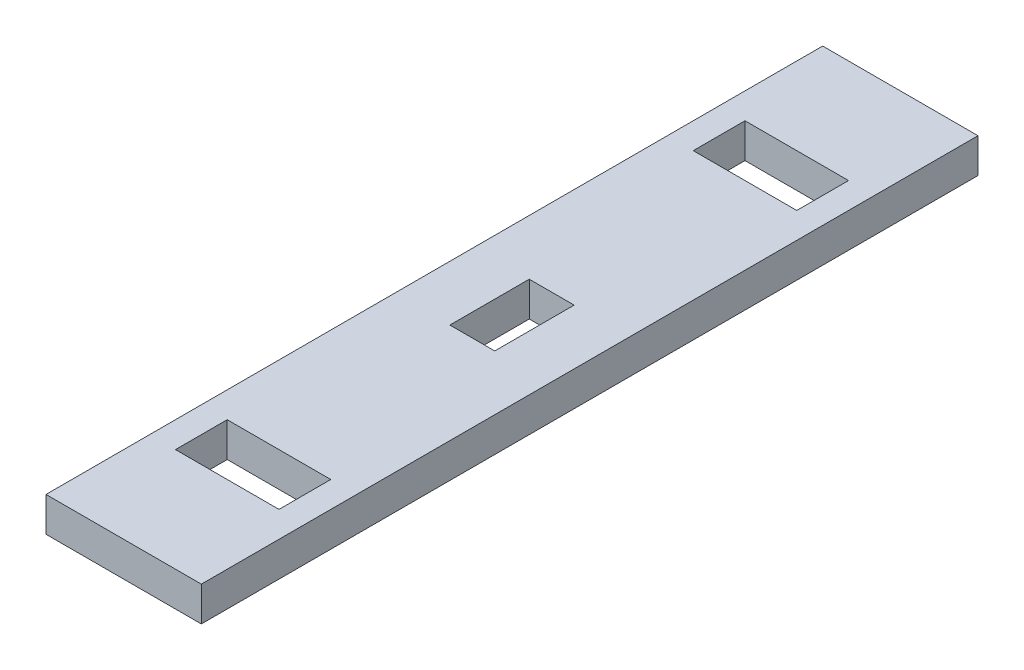
from build123d import *

# Parameters (mm, degrees)
ESQUISSE1_W                  = 9
ESQUISSE1_H                  = 45
ESQUISSE1_W_2                = 6
ESQUISSE1_H_2                = 3
BOSS_EXTRU_1_DEPTH           = 2
ENL_V_MAT_EXTRU_1_DEPTH      = 44.887394917
ENL_V_MAT_EXTRU_1_DEPTH_BACK = 44.887394917
ESQUISSE2_W                  = 2.6
ESQUISSE2_H                  = 4.6


with BuildPart() as part:
    # Esquisse1 → Boss.-Extru.1 (new body)
    with BuildSketch(Plane(origin=(0, 0, 0), x_dir=(1, 0, 0), z_dir=(0, 1, 0))):
        with Locations((3.408982136, 20.622516556)):
            Rectangle(ESQUISSE1_W, ESQUISSE1_H)
        with Locations((3.408982136, 35.622516556)):
            Rectangle(ESQUISSE1_W_2, ESQUISSE1_H_2, mode=Mode.SUBTRACT)
        with Locations((3.408982136, 5.622516556)):
            Rectangle(ESQUISSE1_W_2, ESQUISSE1_H_2, mode=Mode.SUBTRACT)
    extrude(amount=BOSS_EXTRU_1_DEPTH)

    # Esquisse2 → Enlèv. mat.-Extru.1 (cut, two sides: drawn at the far end of the back side and taken through both)
    with BuildSketch(Plane.XZ.offset(-ENL_V_MAT_EXTRU_1_DEPTH_BACK)):
        with Locations((3.408982136, -20.622516556)):
            Rectangle(ESQUISSE2_W, ESQUISSE2_H)
    extrude(amount=ENL_V_MAT_EXTRU_1_DEPTH + ENL_V_MAT_EXTRU_1_DEPTH_BACK, mode=Mode.SUBTRACT)


solid = part.part
